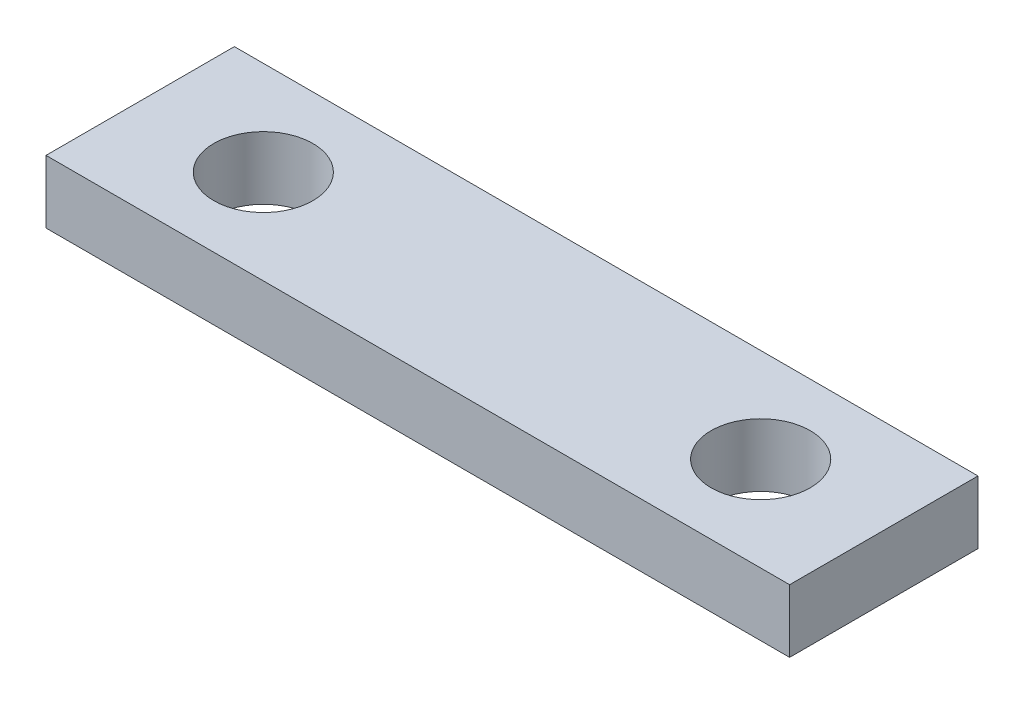
from build123d import *

# Parameters (mm, degrees)
SKETCH1_W           = 75
SKETCH1_H           = 19
SKETCH1_R           = 5
BOSS_EXTRUDE1_DEPTH = 6.35


with BuildPart() as part:
    # Sketch1 → Boss-Extrude1 (new body)
    with BuildSketch(Plane(origin=(0, 0, 0), x_dir=(1, 0, 0), z_dir=(0, 1, 0))):
        with Locations((-37.5, -9.5)):
            Rectangle(SKETCH1_W, SKETCH1_H)
        with Locations(Location((-62.58, -9.5, 0), (0, 0, 270))):
            Circle(SKETCH1_R, mode=Mode.SUBTRACT)
        with Locations(Location((-12.42, -9.5, 0), (0, 0, 270))):
            Circle(SKETCH1_R, mode=Mode.SUBTRACT)
    extrude(amount=BOSS_EXTRUDE1_DEPTH)


solid = part.part
